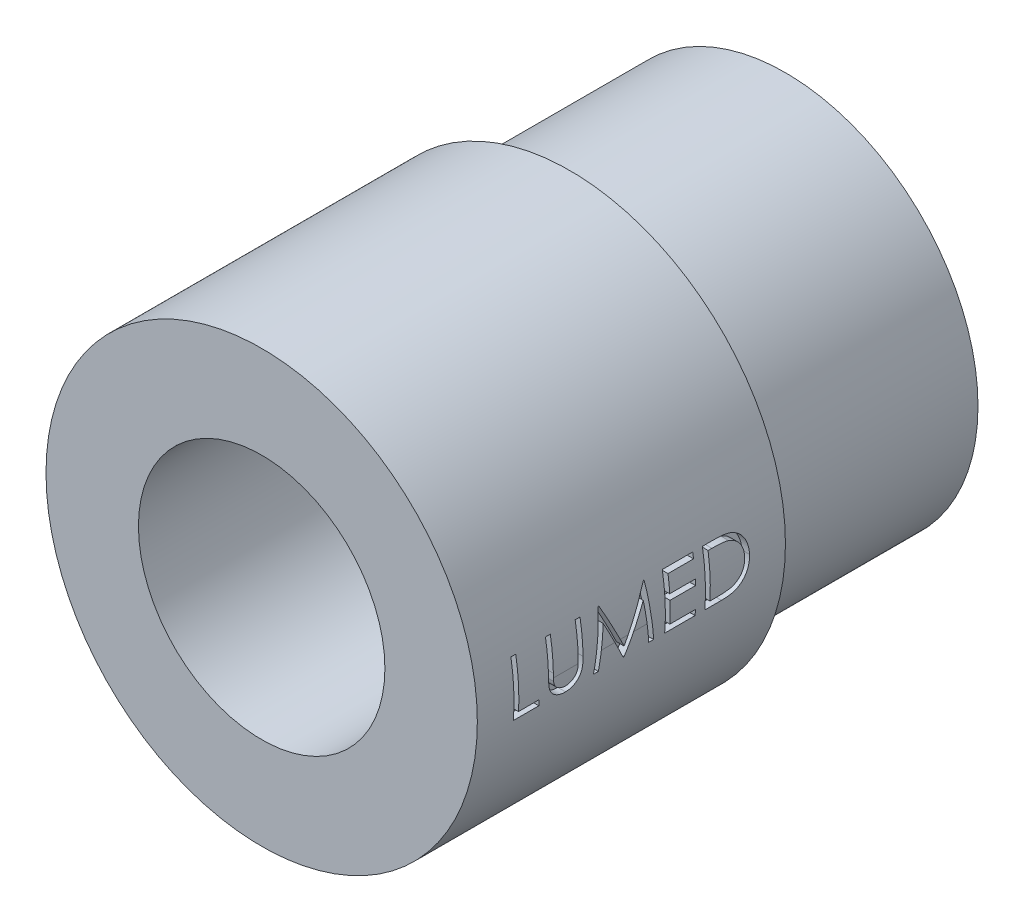
from build123d import *

# Parameters (mm, degrees)
SKETCH1_R               = 12.5
SMALLO_D_DEPTH          = 14
SKETCH2_R               = 14
LARGEO_D_DEPTH          = 20
SKETCH3_R               = 8
BORE_DEPTH              = 40.344631146
CUT_EXTRUDE2_REACH      = 61.345
CUT_EXTRUDE2_END_RADIUS = 13.5
CUT_EXTRUDE2_START      = 20


with BuildPart() as part:
    # Sketch1 → SmallO.D. (new body)
    with BuildSketch(Plane.XY):
        Circle(SKETCH1_R)
    extrude(amount=SMALLO_D_DEPTH)

    # Sketch2 → LargeO.D. (add)
    with BuildSketch(Plane.XY.offset(14)):
        Circle(SKETCH2_R)
    extrude(amount=LARGEO_D_DEPTH)

    # Sketch3 → Bore (cut, through all)
    with BuildSketch(Plane.XY.offset(34)):
        Circle(SKETCH3_R)
    extrude(amount=-BORE_DEPTH, mode=Mode.SUBTRACT)

    # Cut-Extrude2: up to this cylinder (the profile starts outside it)
    cut_extrude2_end = Plane(origin=(0, 0, 25.3055355), z_dir=(0, 0, -1)) * Cylinder(CUT_EXTRUDE2_END_RADIUS, 163.007709, mode=Mode.PRIVATE)
    # Sketch4 → Cut-Extrude2 (cut, up to the surface)
    with BuildSketch(Plane(origin=(0, 0, 0), x_dir=(0, 0, -1), z_dir=(1, 0, 0)).offset(CUT_EXTRUDE2_START), mode=Mode.PRIVATE) as cut_extrude2_sk1:
        Polygon((-31.621441642, 2.362993074), (-31.307339078, 2.362993074), (-31.307339078, -0.778032567), (-29.961185232, -0.778032567), (-29.961185232, -1.137006926), (-31.621441642, -1.137006926), align=None)
    cut_extrude2_tool1 = extrude(cut_extrude2_sk1.sketch, amount=-CUT_EXTRUDE2_REACH, mode=Mode.PRIVATE) - cut_extrude2_end
    add(cut_extrude2_tool1.solids().sort_by_distance((20, 2.324255, 31.46439))[0], mode=Mode.SUBTRACT)
    # Sketch4 → Cut-Extrude2 (cut, up to the surface)
    with BuildSketch(Plane(origin=(0, 0, 0), x_dir=(0, 0, -1), z_dir=(1, 0, 0)).offset(CUT_EXTRUDE2_START), mode=Mode.PRIVATE) as cut_extrude2_sk2:
        with BuildLine():
            Line((-29.377851898, 2.362993074), (-29.063749334, 2.362993074))
            Line((-29.063749334, 2.362993074), (-29.063749334, 0.265937786))
            add(Edge.make_bspline(
                [(-29.063749334, 0.265937786), (-29.063796078, 0.23625705), (-29.063884783, 0.179932739), (-29.063292269, 0.099764439), (-29.061632901, 0.02849198), (-29.060586741, -0.034159368), (-29.058259407, -0.087902115), (-29.056361361, -0.133027426), (-29.053920804, -0.169321629), (-29.050987686, -0.190502555), (-29.049726898, -0.199607086)],
                knots=[0, 0, 0, 0, 1.528628734, 2.90083645, 4.128790002, 5.200304208, 6.127813768, 6.898992206, 7.526736466, 8, 8, 8, 8], degree=3))
            add(Edge.make_bspline(
                [(-29.049726898, -0.199607086), (-29.044549439, -0.232453849), (-29.034486253, -0.296296578), (-29.008839875, -0.38720486), (-28.973022374, -0.469136318), (-28.930579332, -0.54464761), (-28.87464672, -0.61163697), (-28.807643185, -0.673348622), (-28.726465416, -0.727320427), (-28.636204811, -0.776671239), (-28.538919573, -0.816336321), (-28.439508307, -0.846329686), (-28.339465328, -0.864608585), (-28.272489163, -0.866725124), (-28.239230103, -0.867776156)],
                knots=[0, 0, 0, 0, 1.035780045, 2.013197591, 2.933192213, 3.817615948, 4.702609284, 5.640816605, 6.646850145, 7.73207398, 8.84249596, 9.914020372, 10.964143139, 12, 12, 12, 12], degree=3))
            add(Edge.make_bspline(
                [(-28.239230103, -0.867776156), (-28.210676363, -0.866702306), (-28.153733801, -0.864560808), (-28.06912737, -0.851299377), (-27.986727262, -0.827398811), (-27.906126582, -0.796559053), (-27.830575597, -0.755811462), (-27.760032155, -0.708740622), (-27.697068221, -0.653529746), (-27.639610223, -0.592429402), (-27.589575287, -0.523489602), (-27.546204146, -0.448211464), (-27.510678216, -0.365462117), (-27.493134691, -0.307307694), (-27.48412193, -0.277431605)],
                knots=[0, 0, 0, 0, 0.994687771, 1.983630487, 2.973142513, 3.978332533, 4.983357753, 5.956394766, 6.925816176, 7.893390482, 8.871859704, 9.88551698, 10.913711441, 12, 12, 12, 12], degree=3))
            add(Edge.make_bspline(
                [(-27.48412193, -0.277431605), (-27.481121805, -0.265083031), (-27.474436317, -0.237565431), (-27.468189272, -0.19104414), (-27.461682746, -0.136154776), (-27.457168176, -0.072502963), (-27.452766956, -0.000301991), (-27.450133883, 0.080824267), (-27.44891685, 0.170581228), (-27.44855417, 0.233218389), (-27.448364719, 0.265937786)],
                knots=[0, 0, 0, 0, 0.558680831, 1.244966039, 2.062412453, 2.990489873, 4.051219941, 5.244515665, 6.560634259, 8, 8, 8, 8], degree=3))
            Line((-27.448364719, 0.265937786), (-27.448364719, 2.362993074))
            Line((-27.448364719, 2.362993074), (-27.134262155, 2.362993074))
            Line((-27.134262155, 2.362993074), (-27.134262155, 0.249110863))
            add(Edge.make_bspline(
                [(-27.134262155, 0.249110863), (-27.134516275, 0.211012484), (-27.135012206, 0.136661181), (-27.139312783, 0.027709822), (-27.146169783, -0.075643159), (-27.155857871, -0.173411656), (-27.168694874, -0.265245815), (-27.182970094, -0.351950583), (-27.201149627, -0.432903576), (-27.222383029, -0.508735994), (-27.246656577, -0.580921507), (-27.278097725, -0.649430122), (-27.313522225, -0.716344521), (-27.355536878, -0.78065263), (-27.40274826, -0.842639183), (-27.456199941, -0.901928258), (-27.514124102, -0.959467305), (-27.577483662, -1.013780371), (-27.645234187, -1.063589048), (-27.717174145, -1.107386819), (-27.792750914, -1.144410436), (-27.87176804, -1.174886361), (-27.954259243, -1.19780096), (-28.040226603, -1.214876116), (-28.129865796, -1.224578413), (-28.190830453, -1.226020343), (-28.221702058, -1.226750515)],
                knots=[0, 0, 0, 0, 1.316592851, 2.569410997, 3.76748051, 4.895814652, 5.963796859, 6.97159953, 7.931736103, 8.829262218, 9.692595152, 10.560224239, 11.431080259, 12.30701507, 13.211635791, 14.121146779, 15.063487852, 16.031507147, 17.00238618, 17.966455255, 18.938106653, 19.907068911, 20.888905087, 21.893141452, 22.933117798, 24, 24, 24, 24], degree=3))
            add(Edge.make_bspline(
                [(-28.221702058, -1.226750515), (-28.255371161, -1.22596575), (-28.32142982, -1.224426043), (-28.418767887, -1.215603293), (-28.512082083, -1.198984899), (-28.602357961, -1.177824955), (-28.688366458, -1.148641218), (-28.771259902, -1.114543093), (-28.849618583, -1.072665833), (-28.924713712, -1.02607244), (-28.994538468, -0.973647802), (-29.058635871, -0.916507628), (-29.117111742, -0.85556725), (-29.168980438, -0.790166885), (-29.215101323, -0.720815178), (-29.254831536, -0.647315938), (-29.28894478, -0.569697622), (-29.306551347, -0.515744421), (-29.315452058, -0.488469265)],
                knots=[0, 0, 0, 0, 1.13879206, 2.234305948, 3.301075583, 4.341971843, 5.366689343, 6.369221514, 7.369726634, 8.367512178, 9.355451585, 10.318319045, 11.268648973, 12.207971039, 13.137398894, 14.081662264, 15.030215811, 16, 16, 16, 16], degree=3))
            add(Edge.make_bspline(
                [(-29.315452058, -0.488469265), (-29.320629217, -0.469836691), (-29.331858588, -0.429422222), (-29.343883886, -0.362535733), (-29.353992967, -0.285520816), (-29.363498525, -0.198372197), (-29.369107483, -0.101022331), (-29.374024922, 0.006486585), (-29.377886541, 0.124284547), (-29.377863769, 0.206339062), (-29.377851898, 0.249110863)],
                knots=[0, 0, 0, 0, 0.625038921, 1.35572334, 2.194682327, 3.136881307, 4.189498639, 5.346923369, 6.617055217, 8, 8, 8, 8], degree=3))
            Line((-29.377851898, 0.249110863), (-29.377851898, 2.362993074))
        make_face()
    cut_extrude2_tool2 = extrude(cut_extrude2_sk2.sketch, amount=-CUT_EXTRUDE2_REACH, mode=Mode.PRIVATE) - cut_extrude2_end
    add(cut_extrude2_tool2.solids().sort_by_distance((20, 2.320661, 29.220801))[0], mode=Mode.SUBTRACT)
    # Sketch4 → Cut-Extrude2 (cut, up to the surface)
    with BuildSketch(Plane(origin=(0, 0, 0), x_dir=(0, 0, -1), z_dir=(1, 0, 0)).offset(CUT_EXTRUDE2_START), mode=Mode.PRIVATE) as cut_extrude2_sk3:
        Polygon((-26.416313437, -1.137006926), (-25.954274174, 2.362993074), (-25.909402379, 2.362993074), (-24.46439036, -0.508801797), (-23.022883949, 2.362993074), (-22.977311033, 2.362993074), (-22.512467283, -1.137006926), (-22.82797209, -1.137006926), (-23.163108308, 1.381422562), (-24.426529783, -1.137006926), (-24.497343084, -1.137006926), (-25.765672411, 1.387031536), (-26.100107507, -1.137006926), align=None)
    cut_extrude2_tool3 = extrude(cut_extrude2_sk3.sketch, amount=-CUT_EXTRUDE2_REACH, mode=Mode.PRIVATE) - cut_extrude2_end
    add(cut_extrude2_tool3.solids().sort_by_distance((20, 0.606131, 26.133314))[0], mode=Mode.SUBTRACT)
    # Sketch4 → Cut-Extrude2 (cut, up to the surface)
    with BuildSketch(Plane(origin=(0, 0, 0), x_dir=(0, 0, -1), z_dir=(1, 0, 0)).offset(CUT_EXTRUDE2_START), mode=Mode.PRIVATE) as cut_extrude2_sk4:
        Polygon((-21.794518565, 2.362993074), (-19.82015959, 2.362993074), (-19.82015959, 2.004018715), (-21.480416001, 2.004018715), (-21.480416001, 0.927095638), (-19.82015959, 0.927095638), (-19.82015959, 0.56812128), (-21.480416001, 0.56812128), (-21.480416001, -0.778032567), (-19.82015959, -0.778032567), (-19.82015959, -1.137006926), (-21.794518565, -1.137006926), align=None)
    cut_extrude2_tool4 = extrude(cut_extrude2_sk4.sketch, amount=-CUT_EXTRUDE2_REACH, mode=Mode.PRIVATE) - cut_extrude2_end
    add(cut_extrude2_tool4.solids().sort_by_distance((20, 0.64078, 21.026159))[0], mode=Mode.SUBTRACT)
    # Sketch4 → Cut-Extrude2 (cut, up to the surface)
    with BuildSketch(Plane(origin=(0, 0, 0), x_dir=(0, 0, -1), z_dir=(1, 0, 0)).offset(CUT_EXTRUDE2_START), mode=Mode.PRIVATE) as cut_extrude2_sk5:
        with BuildLine():
            Line((-19.191954462, -1.137006926), (-19.191954462, 2.362993074))
            Line((-19.191954462, 2.362993074), (-18.485223693, 2.362993074))
            add(Edge.make_bspline(
                [(-18.485223693, 2.362993074), (-18.423754705, 2.362550504), (-18.30499694, 2.361695461), (-18.133384492, 2.35627407), (-17.97460073, 2.346683604), (-17.829167871, 2.332714078), (-17.696686659, 2.315561045), (-17.57752805, 2.29406064), (-17.471075908, 2.26867247), (-17.405606467, 2.24702702), (-17.37464677, 2.236791151)],
                knots=[0, 0, 0, 0, 1.314313732, 2.53924729, 3.670748893, 4.714932338, 5.66265055, 6.526160246, 7.303039223, 8, 8, 8, 8], degree=3))
            add(Edge.make_bspline(
                [(-17.37464677, 2.236791151), (-17.334152031, 2.221360446), (-17.254080838, 2.190848952), (-17.140073716, 2.13329265), (-17.032748353, 2.068079548), (-16.931529208, 1.995123686), (-16.838728382, 1.912359337), (-16.750720485, 1.823302252), (-16.671105761, 1.724713911), (-16.598197465, 1.618638923), (-16.532461806, 1.506326871), (-16.475322648, 1.387991763), (-16.427868654, 1.264234555), (-16.388475428, 1.135399407), (-16.35742897, 1.001203029), (-16.336247039, 0.861489163), (-16.322276049, 0.716809973), (-16.320871997, 0.61863551), (-16.32015959, 0.568822401)],
                knots=[0, 0, 0, 0, 0.984719456, 1.947108742, 2.898477687, 3.838006223, 4.779231079, 5.722358779, 6.681677486, 7.655904652, 8.64651281, 9.637519902, 10.640069247, 11.656948941, 12.698408672, 13.768548281, 14.867775369, 16, 16, 16, 16], degree=3))
            add(Edge.make_bspline(
                [(-16.32015959, 0.568822401), (-16.320788558, 0.525561163), (-16.322028004, 0.440310374), (-16.33315732, 0.314669478), (-16.34933364, 0.192755907), (-16.374377838, 0.075150207), (-16.404780351, -0.039178011), (-16.443744503, -0.149010255), (-16.488379999, -0.255354065), (-16.540429877, -0.356771541), (-16.597571262, -0.452854913), (-16.658893005, -0.543430441), (-16.724329701, -0.627205663), (-16.794505334, -0.704434275), (-16.86851305, -0.774999853), (-16.946837381, -0.839491869), (-17.029680432, -0.896648423), (-17.116671154, -0.948715532), (-17.210347284, -0.994135887), (-17.31248315, -1.032565897), (-17.423514328, -1.064412512), (-17.543168285, -1.090983408), (-17.671651762, -1.112060711), (-17.809090728, -1.126187103), (-17.955274018, -1.135740036), (-18.055653283, -1.136576429), (-18.107319046, -1.137006926)],
                knots=[0, 0, 0, 0, 1.105936401, 2.179363191, 3.223086493, 4.248585256, 5.251745608, 6.245858792, 7.225916811, 8.198733463, 9.158002045, 10.082870192, 10.993790845, 11.873723703, 12.748670949, 13.606408763, 14.465103618, 15.319838547, 16.196477973, 17.123216899, 18.106603292, 19.147568657, 20.255746949, 21.433717677, 22.679120308, 24, 24, 24, 24], degree=3))
            Line((-18.107319046, -1.137006926), (-19.191954462, -1.137006926))
        make_face()
        with BuildLine():
            Line((-18.877851898, -0.778032567), (-18.47610911, -0.778032567))
            add(Edge.make_bspline(
                [(-18.47610911, -0.778032567), (-18.418380739, -0.77778447), (-18.307347941, -0.77730729), (-18.147689943, -0.773120087), (-18.001810547, -0.766278149), (-17.869689037, -0.756703072), (-17.751400013, -0.744034456), (-17.646696263, -0.729909554), (-17.555921005, -0.712312103), (-17.500991568, -0.696361144), (-17.475608308, -0.688990099)],
                knots=[0, 0, 0, 0, 1.375205317, 2.645023457, 3.804390687, 4.853969522, 5.800190428, 6.637939096, 7.370582563, 8, 8, 8, 8], degree=3))
            add(Edge.make_bspline(
                [(-17.475608308, -0.688990099), (-17.443659946, -0.67773854), (-17.380526308, -0.655504167), (-17.289645223, -0.614946506), (-17.204888218, -0.566904436), (-17.124778193, -0.513502162), (-17.050451538, -0.45285616), (-16.981027421, -0.386285171), (-16.91664562, -0.313450396), (-16.857971312, -0.234442235), (-16.805463008, -0.149752439), (-16.759991778, -0.060213606), (-16.720140247, 0.033193205), (-16.688861654, 0.131902363), (-16.66434607, 0.235031422), (-16.646981382, 0.342587635), (-16.636166658, 0.454550917), (-16.63490521, 0.530703041), (-16.634262155, 0.569523523)],
                knots=[0, 0, 0, 0, 0.998632004, 1.973411704, 2.929992603, 3.868527914, 4.809262121, 5.754881198, 6.702106254, 7.672490631, 8.653608572, 9.636854334, 10.631411391, 11.644891563, 12.686317036, 13.754757253, 14.855430412, 16, 16, 16, 16], degree=3))
            add(Edge.make_bspline(
                [(-16.634262155, 0.569523523), (-16.634775442, 0.610457003), (-16.6357838, 0.690871188), (-16.64845811, 0.808861883), (-16.666979665, 0.922342534), (-16.693763351, 1.031320729), (-16.72789423, 1.136009081), (-16.770488872, 1.235828591), (-16.819155491, 1.33183346), (-16.877058828, 1.421807826), (-16.940474422, 1.506900935), (-17.010852301, 1.584855851), (-17.087074339, 1.655850151), (-17.168309189, 1.720989464), (-17.256846288, 1.777653139), (-17.350599979, 1.828339821), (-17.45094565, 1.871355712), (-17.520758346, 1.894234575), (-17.556237315, 1.905861664)],
                knots=[0, 0, 0, 0, 1.122418816, 2.205001699, 3.251619955, 4.274784885, 5.280384055, 6.268708349, 7.249350384, 8.229342522, 9.199999885, 10.157847722, 11.105861043, 12.055065948, 13.010012805, 13.98527497, 14.976112212, 16, 16, 16, 16], degree=3))
            add(Edge.make_bspline(
                [(-17.556237315, 1.905861664), (-17.585588461, 1.913978092), (-17.647997051, 1.931235845), (-17.749836516, 1.950061217), (-17.864451665, 1.966665716), (-17.992351366, 1.980723755), (-18.133389825, 1.990811077), (-18.287675513, 1.998382391), (-18.455275118, 2.003489024), (-18.571457652, 2.003837731), (-18.631758148, 2.004018715)],
                knots=[0, 0, 0, 0, 0.674548936, 1.434276114, 2.292660221, 3.240891867, 4.284742987, 5.42552168, 6.663806718, 8, 8, 8, 8], degree=3))
            Line((-18.631758148, 2.004018715), (-18.877851898, 2.004018715))
            Line((-18.877851898, 2.004018715), (-18.877851898, -0.778032567))
        make_face(mode=Mode.SUBTRACT)
    cut_extrude2_tool5 = extrude(cut_extrude2_sk5.sketch, amount=-CUT_EXTRUDE2_REACH, mode=Mode.PRIVATE) - cut_extrude2_end
    add(cut_extrude2_tool5.solids().sort_by_distance((20, 0.612993, 19.146681))[0], mode=Mode.SUBTRACT)


solid = part.part
